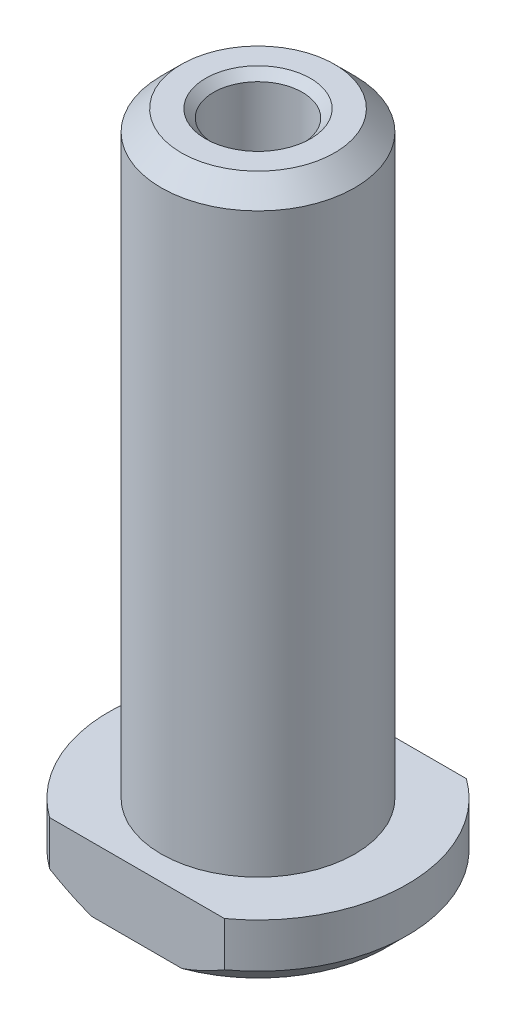
from build123d import *

# Parameters (mm, degrees)
EXTRUDE_1_DEPTH = 16
SKETCH_2_W      = 24
SKETCH_2_H      = 148
CHAMFER_1_SIZE  = 5
CHAMFER_2_SIZE  = 2


with BuildPart() as part:
    # Эскиз1 → Бобышка-Вытянуть1 (new body)
    with BuildSketch(Plane.XZ.offset(164)):
        with BuildLine():
            Line((21.656407828, 30), (-21.656407828, 30))
            ThreePointArc((-21.656407828, 30), (-37, 0), (-21.656407828, -30))
            Line((-21.656407828, -30), (21.656407828, -30))
            ThreePointArc((21.656407828, -30), (37, 0), (21.656407828, 30))
        make_face()
    extrude(amount=-EXTRUDE_1_DEPTH)

    # Эскиз2 → Повернуть1 (revolve)
    with BuildSketch(Plane(origin=(0, 0, 0), x_dir=(-1, 0, 0), z_dir=(0, 0, -1)), mode=Mode.PRIVATE) as revolve_1_sk:
        with Locations((-12, -74)):
            Rectangle(SKETCH_2_W, SKETCH_2_H)
    revolve(revolve_1_sk.sketch.rotate(Axis((0, -148, 0), (0, 1, 0)), 270), axis=Axis((0, -148, 0), (0, 1, 0)))

    # Эскиз3 → Цековка для  болта с шестигранной головкой M301 (revolve, cut)
    with BuildSketch(Plane(origin=(0, 0, 0), x_dir=(0, 0, 1), z_dir=(1, 0, 0))):
        Polygon((0, 0), (0, 124.237604307), (16, 115), (16, 65), (11, 65), (11, 0), align=None)
    revolve(axis=Axis((0, 6.35, 0), (0, -1, 0)), mode=Mode.SUBTRACT)

    # Фаска1
    chamfer_1_edges = [part.edges().sort_by_distance(p)[0] for p in [
        (0, 0, -24),
        (-37, -164, 0),
        (37, -164, 0),
    ]]
    chamfer(chamfer_1_edges, length=CHAMFER_1_SIZE)

    # Фаска2
    chamfer_2_edges = [part.edges().sort_by_distance(p)[0] for p in [
        (0, 0, -11),
    ]]
    chamfer(chamfer_2_edges, length=CHAMFER_2_SIZE)


solid = part.part
